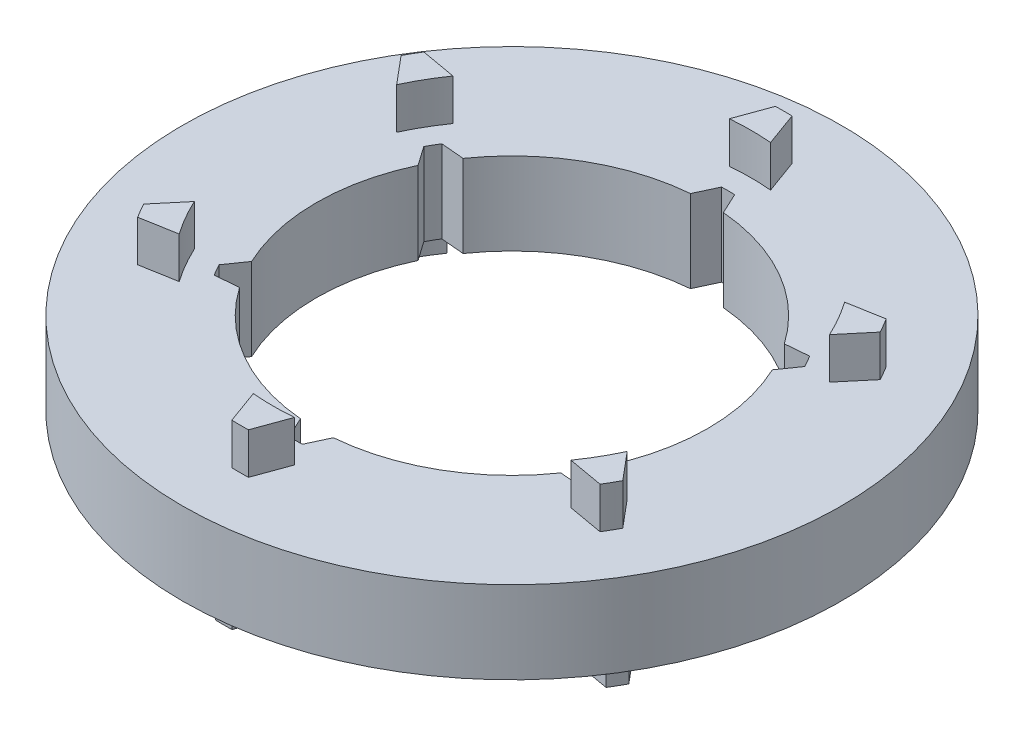
from build123d import *

# Parameters (mm, degrees)
SKETCH1_R           = 40
BOSS_EXTRUDE1_DEPTH = 10
BOSS_EXTRUDE2_DEPTH = 5
BOSS_EXTRUDE4_START = -10
BOSS_EXTRUDE4_DEPTH = 5


with BuildPart() as part:
    # Sketch1 → Boss-Extrude1 (new body)
    with BuildSketch(Plane(origin=(0, 0, 0), x_dir=(1, 0, 0), z_dir=(0, 1, 0))):
        with Locations(Location((0, 0, 0), (0, 0, 270))):
            Circle(SKETCH1_R)
        with BuildLine():
            Line((-2, 23.665639649), (-0.800587161, 26.237788783))
            ThreePointArc((-0.800587161, 26.237788783), (0, 26.25), (0.800587161, 26.237788783))
            Line((0.800587161, 26.237788783), (2, 23.665639649))
            ThreePointArc((2, 23.665639649), (11.875, 20.56810334), (19.495045133, 13.564870632))
            Line((19.495045133, 13.564870632), (22.322298044, 13.812223211))
            ThreePointArc((22.322298044, 13.812223211), (22.733166849, 13.125), (23.122885205, 12.425565572))
            Line((23.122885205, 12.425565572), (21.495045133, 10.100769017))
            ThreePointArc((21.495045133, 10.100769017), (23.75, 0), (21.495045133, -10.100769017))
            Line((21.495045133, -10.100769017), (23.122885205, -12.425565572))
            ThreePointArc((23.122885205, -12.425565572), (22.733166849, -13.125), (22.322298044, -13.812223211))
            Line((22.322298044, -13.812223211), (19.495045133, -13.564870632))
            ThreePointArc((19.495045133, -13.564870632), (11.875, -20.56810334), (2, -23.665639649))
            Line((2, -23.665639649), (0.800587161, -26.237788783))
            ThreePointArc((0.800587161, -26.237788783), (0, -26.25), (-0.800587161, -26.237788783))
            Line((-0.800587161, -26.237788783), (-2, -23.665639649))
            ThreePointArc((-2, -23.665639649), (-11.875, -20.56810334), (-19.495045133, -13.564870632))
            Line((-19.495045133, -13.564870632), (-22.322298044, -13.812223211))
            ThreePointArc((-22.322298044, -13.812223211), (-22.733166849, -13.125), (-23.122885205, -12.425565572))
            Line((-23.122885205, -12.425565572), (-21.495045133, -10.100769017))
            ThreePointArc((-21.495045133, -10.100769017), (-23.75, 0), (-21.495045133, 10.100769017))
            Line((-21.495045133, 10.100769017), (-23.122885205, 12.425565572))
            ThreePointArc((-23.122885205, 12.425565572), (-22.733166849, 13.125), (-22.322298044, 13.812223211))
            Line((-22.322298044, 13.812223211), (-19.495045133, 13.564870632))
            ThreePointArc((-19.495045133, 13.564870632), (-11.875, 20.56810334), (-2, 23.665639649))
        make_face(mode=Mode.SUBTRACT)
    extrude(amount=BOSS_EXTRUDE1_DEPTH)

    # 4,5,6 → Boss-Extrude2 (add)
    with BuildSketch(Plane(origin=(0, 10, 0), x_dir=(1, 0, 0), z_dir=(0, 1, 0))):
        with BuildLine():
            Line((2.5, 28.892040426), (1.010456949, 32.984526323))
            ThreePointArc((1.010456949, 32.984526323), (0, 33), (-1.010456949, 32.984526323))
            Line((-1.010456949, 32.984526323), (-2.5, 28.892040426))
            ThreePointArc((-2.5, 28.892040426), (0, 29), (2.5, 28.892040426))
        make_face()
        with BuildLine():
            Line((23.771240976, 16.611083723), (28.060209253, 17.367344549))
            ThreePointArc((28.060209253, 17.367344549), (28.578838325, 16.5), (29.070666202, 15.617181774))
            Line((29.070666202, 15.617181774), (26.271240976, 12.280956704))
            ThreePointArc((26.271240976, 12.280956704), (25.11473671, 14.5), (23.771240976, 16.611083723))
        make_face()
        with BuildLine():
            Line((26.271240976, -12.280956704), (29.070666202, -15.617181774))
            ThreePointArc((29.070666202, -15.617181774), (28.578838325, -16.5), (28.060209253, -17.367344549))
            Line((28.060209253, -17.367344549), (23.771240976, -16.611083723))
            ThreePointArc((23.771240976, -16.611083723), (25.11473671, -14.5), (26.271240976, -12.280956704))
        make_face()
        with BuildLine():
            Line((2.5, -28.892040426), (1.010456949, -32.984526323))
            ThreePointArc((1.010456949, -32.984526323), (0, -33), (-1.010456949, -32.984526323))
            Line((-1.010456949, -32.984526323), (-2.5, -28.892040426))
            ThreePointArc((-2.5, -28.892040426), (0, -29), (2.5, -28.892040426))
        make_face()
        with BuildLine():
            Line((-23.771240976, -16.611083723), (-28.060209253, -17.367344549))
            ThreePointArc((-28.060209253, -17.367344549), (-28.578838325, -16.5), (-29.070666202, -15.617181774))
            Line((-29.070666202, -15.617181774), (-26.271240976, -12.280956704))
            ThreePointArc((-26.271240976, -12.280956704), (-25.11473671, -14.5), (-23.771240976, -16.611083723))
        make_face()
        with BuildLine():
            Line((-26.271240976, 12.280956704), (-29.070666202, 15.617181774))
            ThreePointArc((-29.070666202, 15.617181774), (-28.578838325, 16.5), (-28.060209253, 17.367344549))
            Line((-28.060209253, 17.367344549), (-23.771240976, 16.611083723))
            ThreePointArc((-23.771240976, 16.611083723), (-25.11473671, 14.5), (-26.271240976, 12.280956704))
        make_face()
    extrude(amount=BOSS_EXTRUDE2_DEPTH)

    # 1,2,3 → Boss-Extrude4 (add)
    with BuildSketch(Plane(origin=(0, 10, 0), x_dir=(1, 0, 0), z_dir=(0, 1, 0)).offset(BOSS_EXTRUDE4_START)):
        with BuildLine():
            Line((2.5, 30.899029111), (1.012702288, 34.985345991))
            ThreePointArc((1.012702288, 34.985345991), (0, 35), (-1.012702288, 34.985345991))
            Line((-1.012702288, 34.985345991), (-2.5, 30.899029111))
            ThreePointArc((-2.5, 30.899029111), (0, 31), (2.5, 30.899029111))
        make_face()
        with BuildLine():
            Line((25.509344162, 17.614578065), (29.791847244, 18.369698903))
            ThreePointArc((29.791847244, 18.369698903), (30.310889132, 17.5), (30.804549532, 16.615647087))
            Line((30.804549532, 16.615647087), (28.009344162, 13.284451046))
            ThreePointArc((28.009344162, 13.284451046), (26.846787517, 15.5), (25.509344162, 17.614578065))
        make_face()
        with BuildLine():
            Line((28.009344162, -13.284451046), (30.804549532, -16.615647087))
            ThreePointArc((30.804549532, -16.615647087), (30.310889132, -17.5), (29.791847244, -18.369698903))
            Line((29.791847244, -18.369698903), (25.509344162, -17.614578065))
            ThreePointArc((25.509344162, -17.614578065), (26.846787517, -15.5), (28.009344162, -13.284451046))
        make_face()
        with BuildLine():
            Line((2.5, -30.899029111), (1.012702288, -34.985345991))
            ThreePointArc((1.012702288, -34.985345991), (0, -35), (-1.012702288, -34.985345991))
            Line((-1.012702288, -34.985345991), (-2.5, -30.899029111))
            ThreePointArc((-2.5, -30.899029111), (0, -31), (2.5, -30.899029111))
        make_face()
        with BuildLine():
            Line((-25.509344162, -17.614578065), (-29.791847244, -18.369698903))
            ThreePointArc((-29.791847244, -18.369698903), (-30.310889132, -17.5), (-30.804549532, -16.615647087))
            Line((-30.804549532, -16.615647087), (-28.009344162, -13.284451046))
            ThreePointArc((-28.009344162, -13.284451046), (-26.846787517, -15.5), (-25.509344162, -17.614578065))
        make_face()
        with BuildLine():
            Line((-28.009344162, 13.284451046), (-30.804549532, 16.615647087))
            ThreePointArc((-30.804549532, 16.615647087), (-30.310889132, 17.5), (-29.791847244, 18.369698903))
            Line((-29.791847244, 18.369698903), (-25.509344162, 17.614578065))
            ThreePointArc((-25.509344162, 17.614578065), (-26.846787517, 15.5), (-28.009344162, 13.284451046))
        make_face()
    extrude(amount=-BOSS_EXTRUDE4_DEPTH)


solid = part.part
